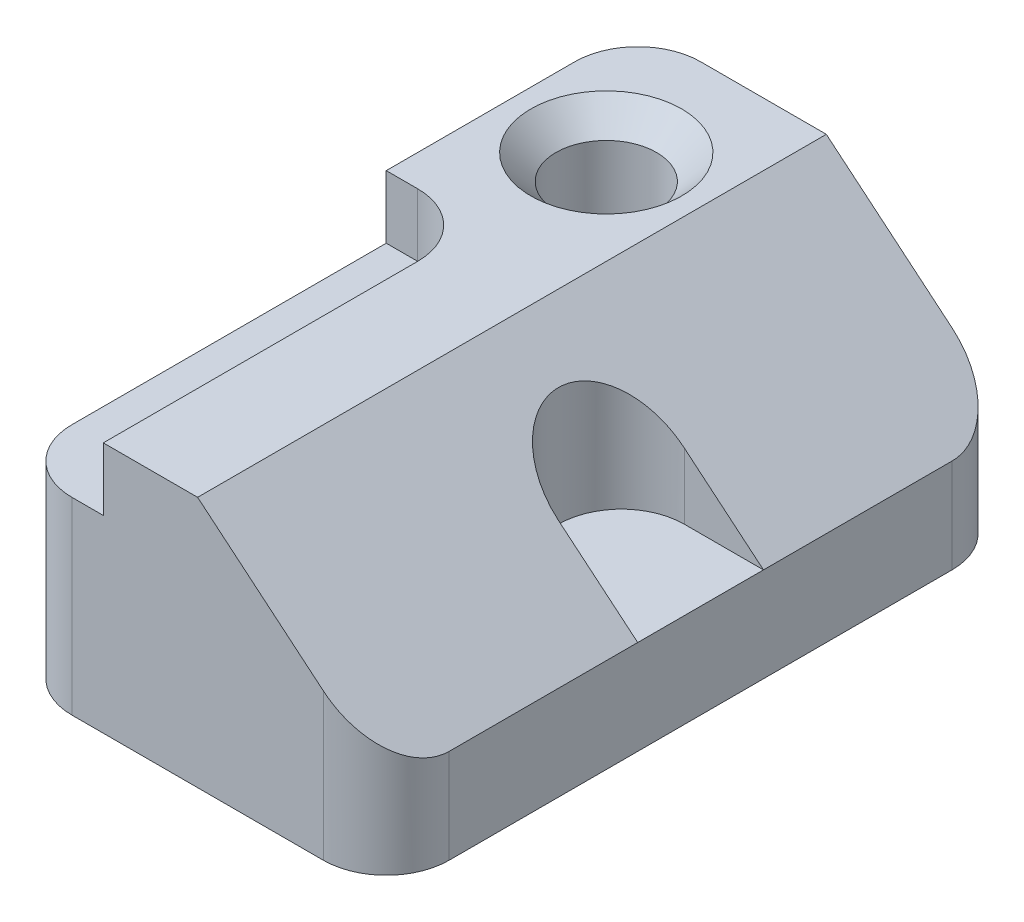
from build123d import *

# Parameters (mm, degrees)
BOSS_EXTRUDE1_DEPTH = 127
SKETCH2_R           = 10.16
CUT_EXTRUDE1_DEPTH  = 157.576115675
CHAMFER1_SIZE       = 5.08
SKETCH3_W           = 19.05
SKETCH3_H           = 76.2
CUT_EXTRUDE2_DEPTH  = 12.7
FILLET1_R           = 12.7
CUT_EXTRUDE4_DEPTH  = 31.75
FILLET2_R           = 12.7


with BuildPart() as part:
    # Sketch1 → Boss-Extrude1 (new body)
    with BuildSketch(Plane.XY):
        Polygon((0, 50.8), (0, 0), (76.2, 0), (76.2, 19.05), (38.1, 50.8), align=None)
    extrude(amount=BOSS_EXTRUDE1_DEPTH)

    # Sketch2 → Cut-Extrude1 (cut, through all)
    with BuildSketch(Plane(origin=(0, 50.8, 0), x_dir=(1, 0, 0), z_dir=(0, 1, 0))):
        with Locations(Location((19.044451167, -25.4, 0), (0, 0, 270))):
            Circle(SKETCH2_R)
    extrude(amount=-CUT_EXTRUDE1_DEPTH, mode=Mode.SUBTRACT)

    # Chamfer1
    chamfer1_edges = [part.edges().sort_by_distance(p)[0] for p in [
        (19.044451167, 50.8, 15.24),
    ]]
    chamfer(chamfer1_edges, length=CHAMFER1_SIZE)

    # Sketch3 → Cut-Extrude2 (cut)
    with BuildSketch(Plane(origin=(0, 50.8, 0), x_dir=(1, 0, 0), z_dir=(0, 1, 0))):
        with Locations((9.525, -88.9)):
            Rectangle(SKETCH3_W, SKETCH3_H)
    extrude(amount=-CUT_EXTRUDE2_DEPTH, mode=Mode.SUBTRACT)

    # Fillet1
    fillet1_edges = [part.edges().sort_by_distance(p)[0] for p in [
        (19.05, 44.45, 50.8),
    ]]
    fillet(fillet1_edges, radius=FILLET1_R)

    # Sketch8 → Cut-Extrude4 (cut)
    with BuildSketch(Plane(origin=(0, 50.8, 0), x_dir=(1, 0, 0), z_dir=(0, 1, 0))):
        with BuildLine():
            Line((76.2, -50.8), (60.198, -50.8))
            ThreePointArc((60.198, -50.8), (47.498, -63.5), (60.198, -76.2))
            Line((60.198, -76.2), (76.2, -76.2))
            Line((76.2, -76.2), (76.2, -50.8))
        make_face()
    extrude(amount=-CUT_EXTRUDE4_DEPTH, mode=Mode.SUBTRACT)

    # Fillet2
    fillet2_edges = [part.edges().sort_by_distance(p)[0] for p in [
        (76.2, 9.525, 127),
        (0, 19.05, 127),
        (76.2, 9.525, 0),
        (0, 25.4, 0),
    ]]
    fillet(fillet2_edges, radius=FILLET2_R)


solid = part.part
